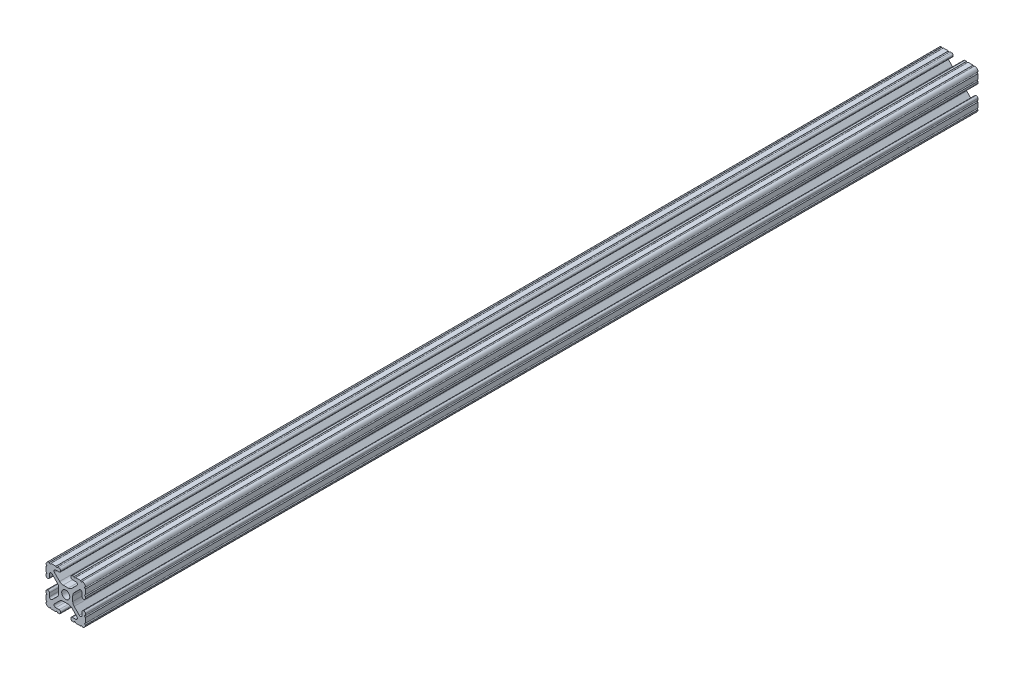
from build123d import *

# Parameters (mm, degrees)
SKETCH1_R           = 2.6035
BOSS_EXTRUDE1_DEPTH = 287.3681959


with BuildPart() as part:
    # Sketch1 → Boss-Extrude1 (new, symmetric)
    with BuildSketch(Plane.XY):
        with BuildLine():
            Line((-7.179650497, -8.645192506), (-3.952270251, -5.423690499))
            ThreePointArc((-3.952270251, -5.423690499), (-2.922936451, -4.736929036), (-1.709253557, -4.4958))
            Line((-1.709253557, -4.4958), (1.709253557, -4.4958))
            ThreePointArc((1.709253557, -4.4958), (2.922936451, -4.736929036), (3.952270251, -5.423690499))
            Line((3.952270251, -5.423690499), (7.179650497, -8.645192506))
            ThreePointArc((7.179650497, -8.645192506), (7.41473083, -9.822813117), (6.416408329, -10.4902))
            Line((6.416408329, -10.4902), (4.287512407, -10.4902))
            ThreePointArc((4.287512407, -10.4902), (3.54574862, -10.79744862), (3.2385, -11.539212407))
            Line((3.2385, -11.539212407), (3.2385, -11.650987593))
            ThreePointArc((3.2385, -11.650987593), (3.54574862, -12.39275138), (4.287512407, -12.7))
            Line((4.287512407, -12.7), (5.317126718, -12.7))
            ThreePointArc((5.317126718, -12.7), (5.825126718, -12.192), (6.333126718, -12.7))
            Line((6.333126718, -12.7), (9.550443118, -12.7))
            ThreePointArc((9.550443118, -12.7), (10.058366869, -12.192000006), (10.566443095, -12.699847501))
            ThreePointArc((10.566443095, -12.699847501), (12.082537762, -12.08250727), (12.699846982, -10.566399977))
            ThreePointArc((12.699846982, -10.566399977), (12.192000006, -10.058323491), (12.7, -9.5504))
            Line((12.7, -9.5504), (12.7, -6.3330836))
            ThreePointArc((12.7, -6.3330836), (12.192, -5.8250836), (12.7, -5.3170836))
            Line((12.7, -5.3170836), (12.7, -4.287469289))
            ThreePointArc((12.7, -4.287469289), (12.39275138, -3.545705502), (11.650987593, -3.238456882))
            Line((11.650987593, -3.238456882), (11.539212407, -3.238456882))
            ThreePointArc((11.539212407, -3.238456882), (10.79744862, -3.545705502), (10.4902, -4.287469289))
            Line((10.4902, -4.287469289), (10.4902, -6.402089023))
            ThreePointArc((10.4902, -6.402089023), (9.856505071, -7.351067942), (8.737131347, -7.129408934))
            Line((8.737131347, -7.129408934), (5.441005833, -3.840816462))
            ThreePointArc((5.441005833, -3.840816462), (4.750877967, -2.809883091), (4.5085, -1.593185507))
            Line((4.5085, -1.593185507), (4.5085, 1.593185507))
            ThreePointArc((4.5085, 1.593185507), (4.750877967, 2.809883091), (5.441005833, 3.840816462))
            Line((5.441005833, 3.840816462), (8.737131347, 7.129408934))
            ThreePointArc((8.737131347, 7.129408934), (9.856505071, 7.351067942), (10.4902, 6.402089023))
            Line((10.4902, 6.402089023), (10.4902, 4.287469289))
            ThreePointArc((10.4902, 4.287469289), (10.79744862, 3.545705502), (11.539212407, 3.238456882))
            Line((11.539212407, 3.238456882), (11.650987593, 3.238456882))
            ThreePointArc((11.650987593, 3.238456882), (12.39275138, 3.545705502), (12.7, 4.287469289))
            Line((12.7, 4.287469289), (12.7, 5.3170836))
            ThreePointArc((12.7, 5.3170836), (12.192, 5.8250836), (12.7, 6.3330836))
            Line((12.7, 6.3330836), (12.7, 9.5504))
            ThreePointArc((12.7, 9.5504), (12.192000006, 10.058323491), (12.699846982, 10.566399977))
            ThreePointArc((12.699846982, 10.566399977), (12.082537762, 12.08250727), (10.566443095, 12.699847501))
            ThreePointArc((10.566443095, 12.699847501), (10.058366869, 12.192000006), (9.550443118, 12.7))
            Line((9.550443118, 12.7), (6.333126718, 12.7))
            ThreePointArc((6.333126718, 12.7), (5.825126718, 12.192), (5.317126718, 12.7))
            Line((5.317126718, 12.7), (4.287512407, 12.7))
            ThreePointArc((4.287512407, 12.7), (3.54574862, 12.39275138), (3.2385, 11.650987593))
            Line((3.2385, 11.650987593), (3.2385, 11.539212407))
            ThreePointArc((3.2385, 11.539212407), (3.54574862, 10.79744862), (4.287512407, 10.4902))
            Line((4.287512407, 10.4902), (6.476788598, 10.4902))
            ThreePointArc((6.476788598, 10.4902), (7.432222385, 9.85140422), (7.207036008, 8.724370562))
            Line((7.207036008, 8.724370562), (3.898272566, 5.423169045))
            ThreePointArc((3.898272566, 5.423169045), (2.869120213, 4.736787962), (1.655778399, 4.4958))
            Line((1.655778399, 4.4958), (-1.655778399, 4.4958))
            ThreePointArc((-1.655778399, 4.4958), (-2.869120213, 4.736787962), (-3.898272566, 5.423169045))
            Line((-3.898272566, 5.423169045), (-7.207036008, 8.724370562))
            ThreePointArc((-7.207036008, 8.724370562), (-7.432222385, 9.85140422), (-6.476788598, 10.4902))
            Line((-6.476788598, 10.4902), (-4.287512407, 10.4902))
            ThreePointArc((-4.287512407, 10.4902), (-3.54574862, 10.79744862), (-3.2385, 11.539212407))
            Line((-3.2385, 11.539212407), (-3.2385, 11.650987593))
            ThreePointArc((-3.2385, 11.650987593), (-3.54574862, 12.39275138), (-4.287512407, 12.7))
            Line((-4.287512407, 12.7), (-5.317126718, 12.7))
            ThreePointArc((-5.317126718, 12.7), (-5.825126718, 12.192), (-6.333126718, 12.7))
            Line((-6.333126718, 12.7), (-9.550443118, 12.7))
            ThreePointArc((-9.550443118, 12.7), (-10.058366869, 12.192000006), (-10.566443095, 12.699847501))
            ThreePointArc((-10.566443095, 12.699847501), (-12.082537762, 12.08250727), (-12.699846982, 10.566399977))
            ThreePointArc((-12.699846982, 10.566399977), (-12.192000006, 10.058323491), (-12.7, 9.5504))
            Line((-12.7, 9.5504), (-12.7, 6.3330836))
            ThreePointArc((-12.7, 6.3330836), (-12.192, 5.8250836), (-12.7, 5.3170836))
            Line((-12.7, 5.3170836), (-12.7, 4.287469289))
            ThreePointArc((-12.7, 4.287469289), (-12.39275138, 3.545705502), (-11.650987593, 3.238456882))
            Line((-11.650987593, 3.238456882), (-11.539212407, 3.238456882))
            ThreePointArc((-11.539212407, 3.238456882), (-10.79744862, 3.545705502), (-10.4902, 4.287469289))
            Line((-10.4902, 4.287469289), (-10.4902, 6.402089023))
            ThreePointArc((-10.4902, 6.402089023), (-9.856505071, 7.351067942), (-8.737131347, 7.129408934))
            Line((-8.737131347, 7.129408934), (-5.441005833, 3.840816462))
            ThreePointArc((-5.441005833, 3.840816462), (-4.750877967, 2.809883091), (-4.5085, 1.593185507))
            Line((-4.5085, 1.593185507), (-4.5085, -1.593185507))
            ThreePointArc((-4.5085, -1.593185507), (-4.750877967, -2.809883091), (-5.441005833, -3.840816462))
            Line((-5.441005833, -3.840816462), (-8.737131347, -7.129408934))
            ThreePointArc((-8.737131347, -7.129408934), (-9.856505071, -7.351067942), (-10.4902, -6.402089023))
            Line((-10.4902, -6.402089023), (-10.4902, -4.287469289))
            ThreePointArc((-10.4902, -4.287469289), (-10.79744862, -3.545705502), (-11.539212407, -3.238456882))
            Line((-11.539212407, -3.238456882), (-11.650987593, -3.238456882))
            ThreePointArc((-11.650987593, -3.238456882), (-12.39275138, -3.545705502), (-12.7, -4.287469289))
            Line((-12.7, -4.287469289), (-12.7, -5.3170836))
            ThreePointArc((-12.7, -5.3170836), (-12.192, -5.8250836), (-12.7, -6.3330836))
            Line((-12.7, -6.3330836), (-12.7, -9.5504))
            ThreePointArc((-12.7, -9.5504), (-12.192000006, -10.058323491), (-12.699846982, -10.566399977))
            ThreePointArc((-12.699846982, -10.566399977), (-12.082537762, -12.08250727), (-10.566443095, -12.699847501))
            ThreePointArc((-10.566443095, -12.699847501), (-10.058366869, -12.192000006), (-9.550443118, -12.7))
            Line((-9.550443118, -12.7), (-6.333126718, -12.7))
            ThreePointArc((-6.333126718, -12.7), (-5.825126718, -12.192), (-5.317126718, -12.7))
            Line((-5.317126718, -12.7), (-4.287512407, -12.7))
            ThreePointArc((-4.287512407, -12.7), (-3.54574862, -12.39275138), (-3.2385, -11.650987593))
            Line((-3.2385, -11.650987593), (-3.2385, -11.539212407))
            ThreePointArc((-3.2385, -11.539212407), (-3.54574862, -10.79744862), (-4.287512407, -10.4902))
            Line((-4.287512407, -10.4902), (-6.416408329, -10.4902))
            ThreePointArc((-6.416408329, -10.4902), (-7.41473083, -9.822813117), (-7.179650497, -8.645192506))
        make_face()
        Circle(SKETCH1_R, mode=Mode.SUBTRACT)
    extrude(amount=BOSS_EXTRUDE1_DEPTH, both=True)


solid = part.part
